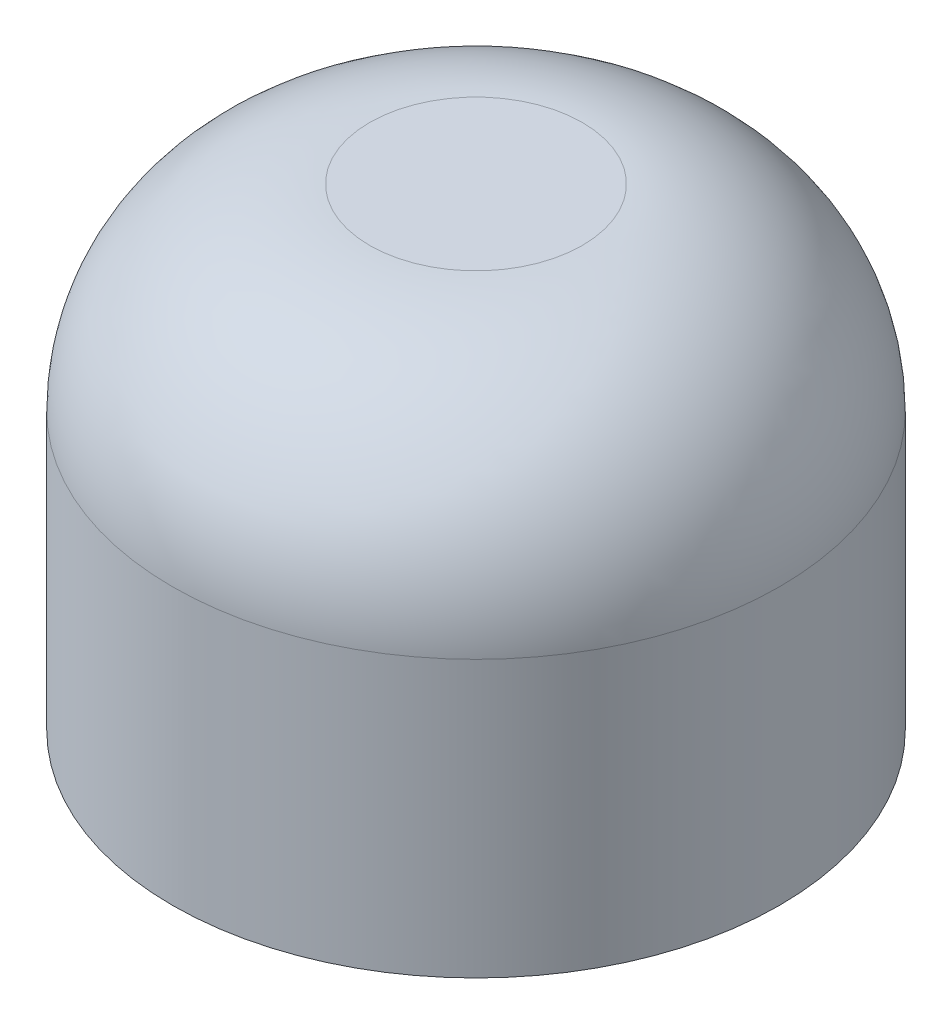
from build123d import *

# Parameters (mm, degrees)
SKETCH1_R           = 1.925
BOSS_EXTRUDE1_DEPTH = 3
FILLET3_R           = 1.25


with BuildPart() as part:
    # Sketch1 → Boss-Extrude1 (new body)
    with BuildSketch(Plane(origin=(0, 0, 0), x_dir=(1, 0, 0), z_dir=(0, 1, 0))):
        with Locations(Location((0, 0, 0), (0, 0, 270))):
            Circle(SKETCH1_R)
    extrude(amount=BOSS_EXTRUDE1_DEPTH)

    # Fillet3
    fillet3_edges = [part.edges().sort_by_distance(p)[0] for p in [
        (0, 3, -1.925),
    ]]
    fillet(fillet3_edges, radius=FILLET3_R)


solid = part.part
